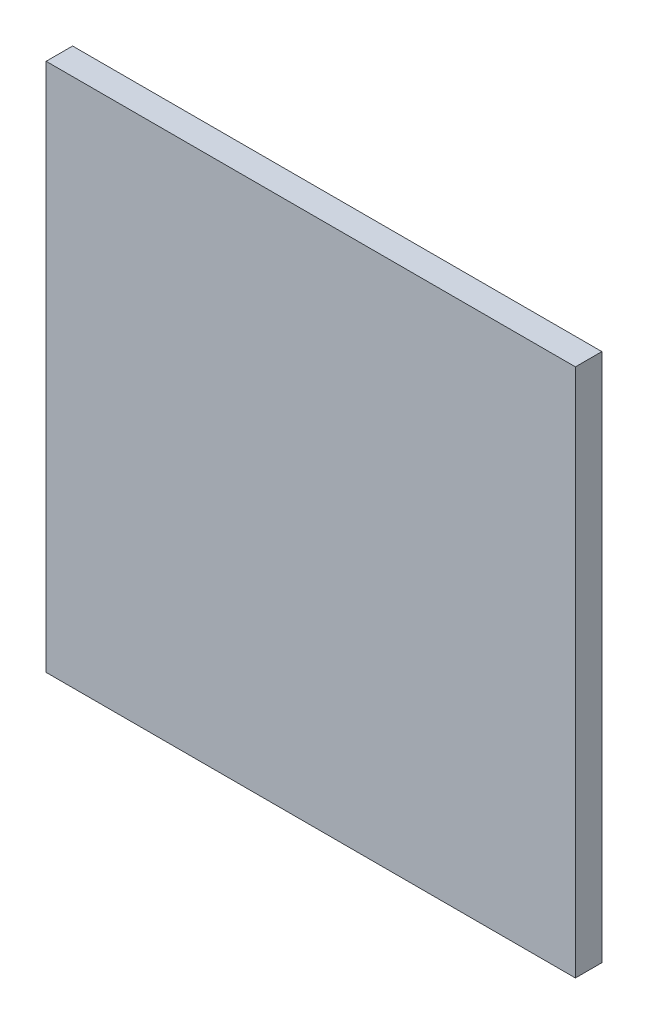
from build123d import *

# Parameters (mm, degrees)
ESQUISSE1_W        = 100
ESQUISSE1_H        = 100
BOSS_EXTRU_1_DEPTH = 5


with BuildPart() as part:
    # Esquisse1 → Boss.-Extru.1 (new body)
    with BuildSketch(Plane.XY):
        with Locations((50, 50)):
            Rectangle(ESQUISSE1_W, ESQUISSE1_H)
    extrude(amount=BOSS_EXTRU_1_DEPTH)


solid = part.part
